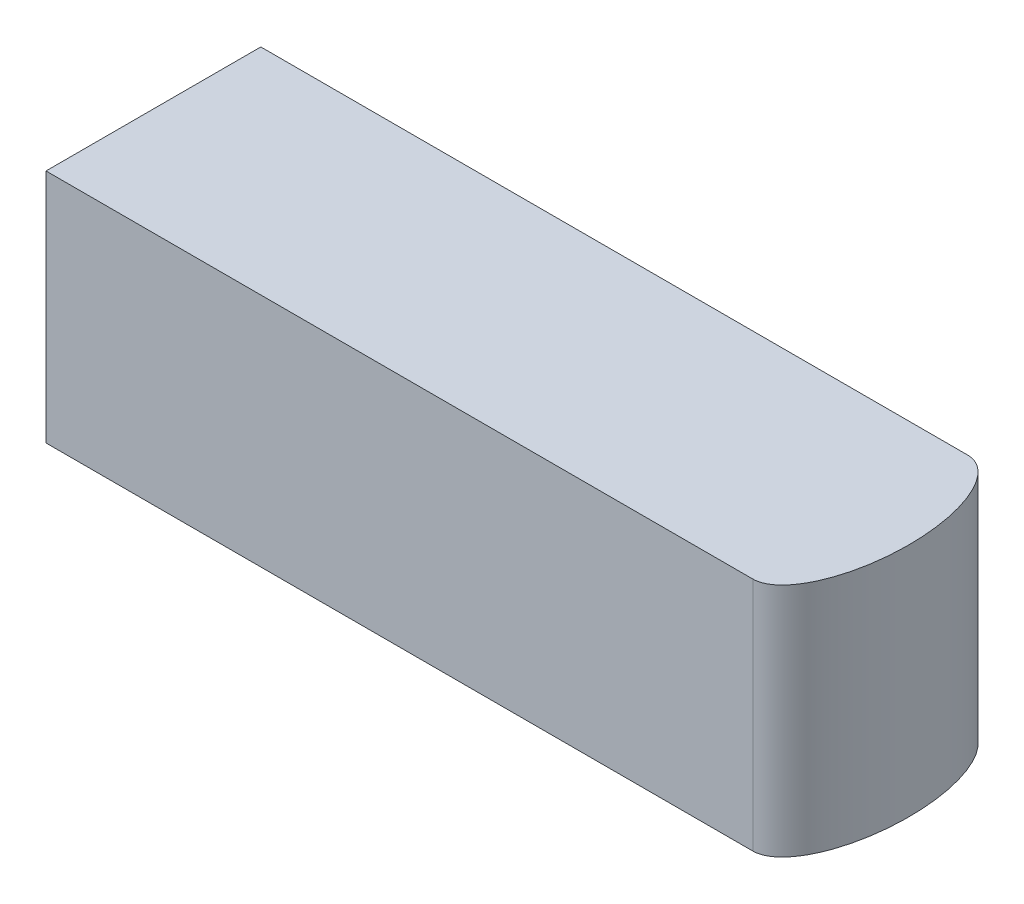
from build123d import *

# Parameters (mm, degrees)
BOSS_EXTRUDE2_DEPTH = 34


with BuildPart() as part:
    # Sketch1 → Boss-Extrude2 (new body)
    with BuildSketch(Plane(origin=(0, 0, 0), x_dir=(1, 0, 0), z_dir=(0, 1, 0))):
        with BuildLine():
            Line((-51, -15.5), (51, -15.5))
            add(Edge.make_bspline(
                [(51, -15.5), (58, -15.5), (58, 0), (58, 15.5), (51, 15.5)],
                knots=[0, 0, 0, 1.570796327, 1.570796327, 3.141592654, 3.141592654, 3.141592654], degree=2, weights=[1, 0.707106781, 1, 0.707106781, 1]))
            Line((51, 15.5), (-51, 15.5))
            Line((-51, 15.5), (-51, -15.5))
        make_face()
    extrude(amount=BOSS_EXTRUDE2_DEPTH)


solid = part.part
